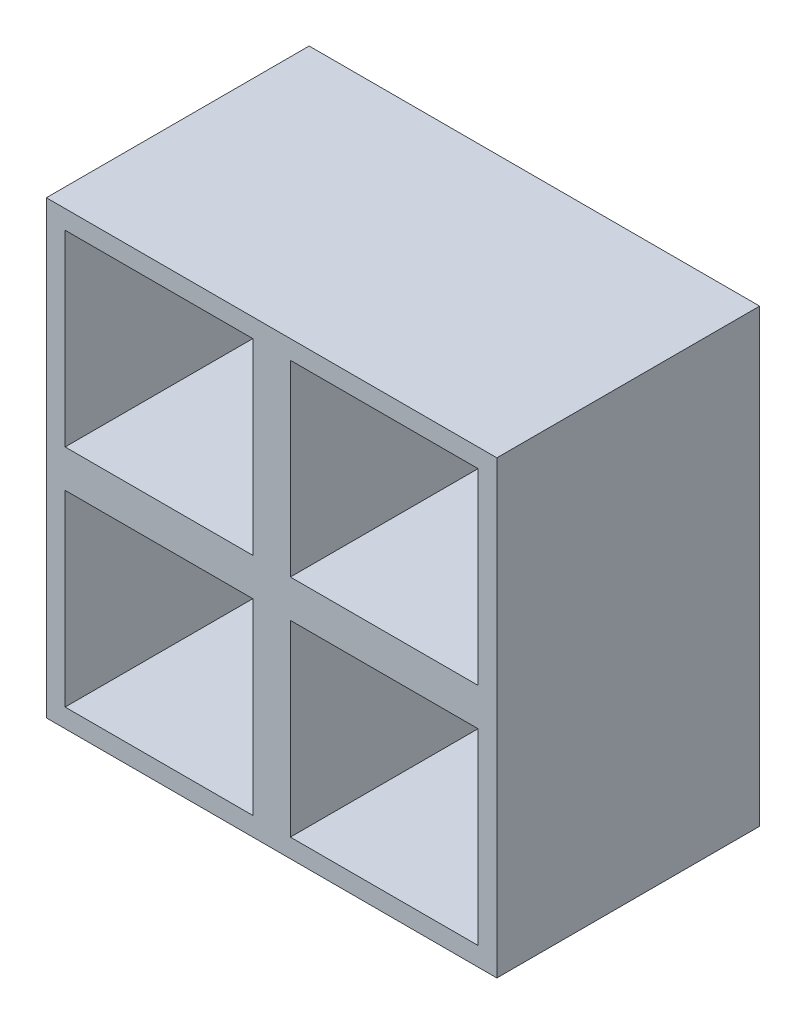
from build123d import *

# Parameters (mm, degrees)
SKETCH_1_W      = 6
SKETCH_1_H      = 6
EXTRUDE_1_DEPTH = 1
SKETCH_2_W      = 6
SKETCH_2_H      = 6
SKETCH_2_W_2    = 2.5
SKETCH_2_H_2    = 2.5
EXTRUDE_2_DEPTH = 2.5


with BuildPart() as part:
    # 스케치1 → 보스-돌출1 (new body)
    with BuildSketch(Plane.XY):
        Rectangle(SKETCH_1_W, SKETCH_1_H)
    extrude(amount=EXTRUDE_1_DEPTH)

    # 스케치2 → 보스-돌출2 (add)
    with BuildSketch(Plane.XY.offset(1)):
        Rectangle(SKETCH_2_W, SKETCH_2_H)
        with Locations((-1.5, -1.5)):
            Rectangle(SKETCH_2_W_2, SKETCH_2_H_2, mode=Mode.SUBTRACT)
        with Locations((1.5, -1.5)):
            Rectangle(SKETCH_2_W_2, SKETCH_2_H_2, mode=Mode.SUBTRACT)
        with Locations((-1.5, 1.5)):
            Rectangle(SKETCH_2_W_2, SKETCH_2_H_2, mode=Mode.SUBTRACT)
        with Locations((1.5, 1.5)):
            Rectangle(SKETCH_2_W_2, SKETCH_2_H_2, mode=Mode.SUBTRACT)
    extrude(amount=EXTRUDE_2_DEPTH)


solid = part.part
